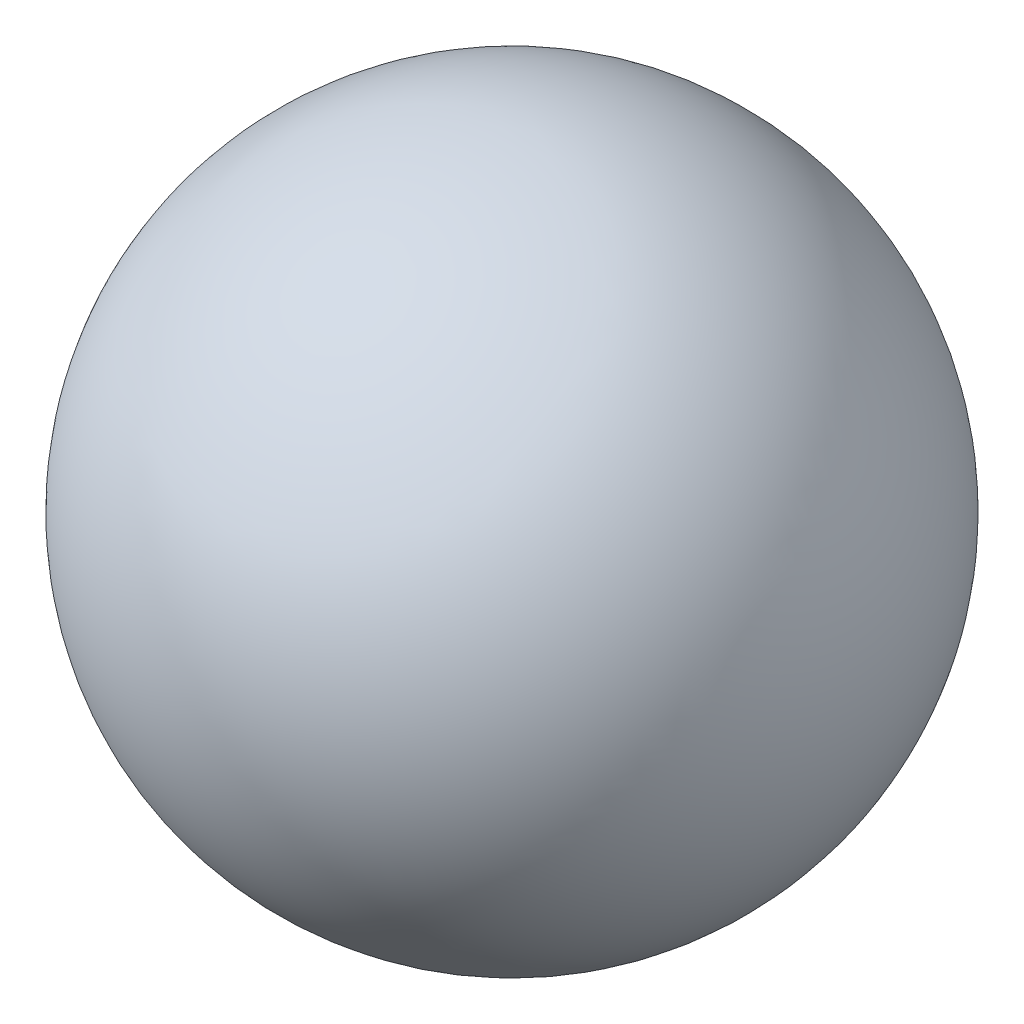
from build123d import *

# Parameters (mm, degrees)
SKETCH2_R          = 2
CUT_EXTRUDE1_DEPTH = 12.5


with BuildPart() as part:
    # SEmiCircleSketch1 → Revolve1 (revolve)
    with BuildSketch(Plane(origin=(0, 0, 0), x_dir=(1, 0, 0), z_dir=(0, 1, 0))):
        with BuildLine():
            Line((0, 0), (0, 25))
            ThreePointArc((0, 25), (-12.5, 12.5), (0, 0))
        make_face()
    revolve(axis=Axis((0, 0, 0), (0, 0, -1)))

    # Sketch2 → Cut-Extrude1 (cut)
    with BuildSketch(Plane(origin=(0, 0, 0), x_dir=(0, 0, -1), z_dir=(1, 0, 0))):
        with Locations((12.5, 0)):
            Circle(SKETCH2_R)
    extrude(amount=-CUT_EXTRUDE1_DEPTH, mode=Mode.SUBTRACT)


solid = part.part
